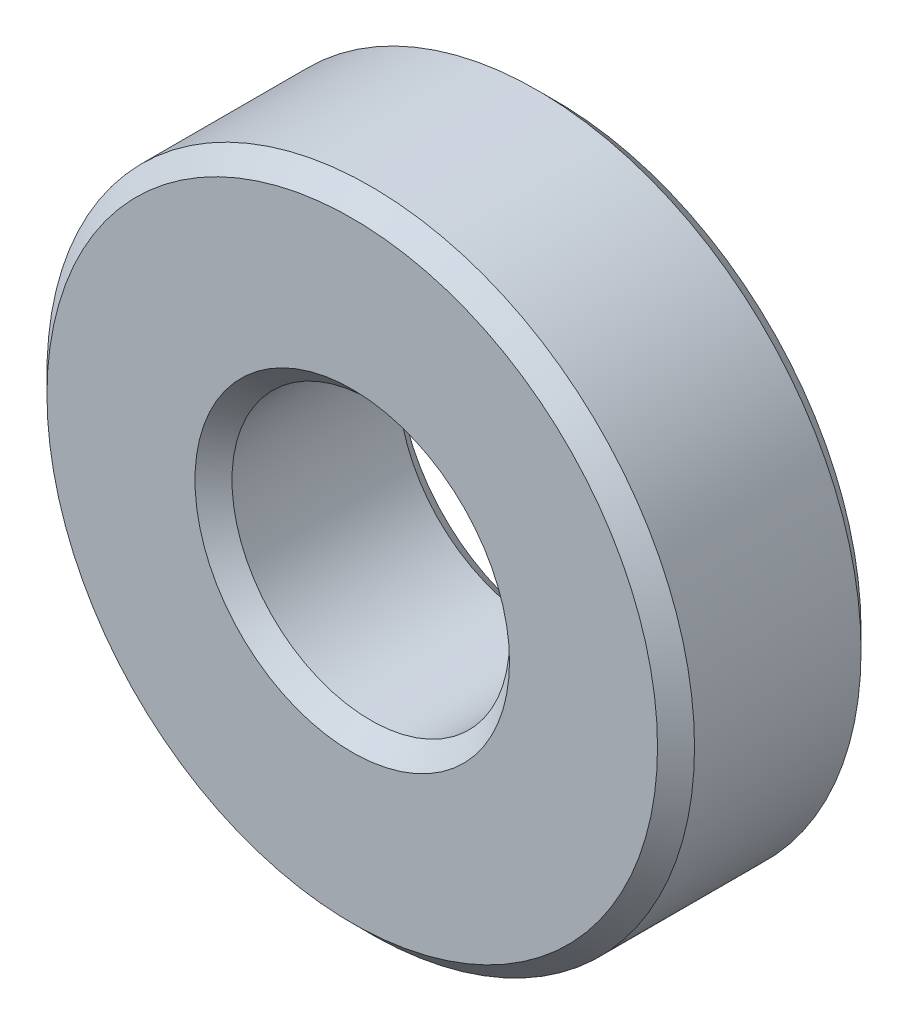
from build123d import *

# Parameters (mm, degrees)
SKETCH_1_R      = 17.5
SKETCH_1_R_2    = 7.5
EXTRUDE_1_DEPTH = 11
CHAMFER_1_SIZE  = 1


with BuildPart() as part:
    # 草图1 → 凸台-拉伸1 (new body)
    with BuildSketch(Plane.XY):
        Circle(SKETCH_1_R)
        Circle(SKETCH_1_R_2, mode=Mode.SUBTRACT)
    extrude(amount=EXTRUDE_1_DEPTH)

    # 倒角1
    chamfer_1_edges = [part.edges().sort_by_distance(p)[0] for p in [
        (-17.5, 0, 0),
        (-17.5, 0, 11),
        (-7.5, 0, 0),
        (-7.5, 0, 11),
    ]]
    chamfer(chamfer_1_edges, length=CHAMFER_1_SIZE)


solid = part.part
